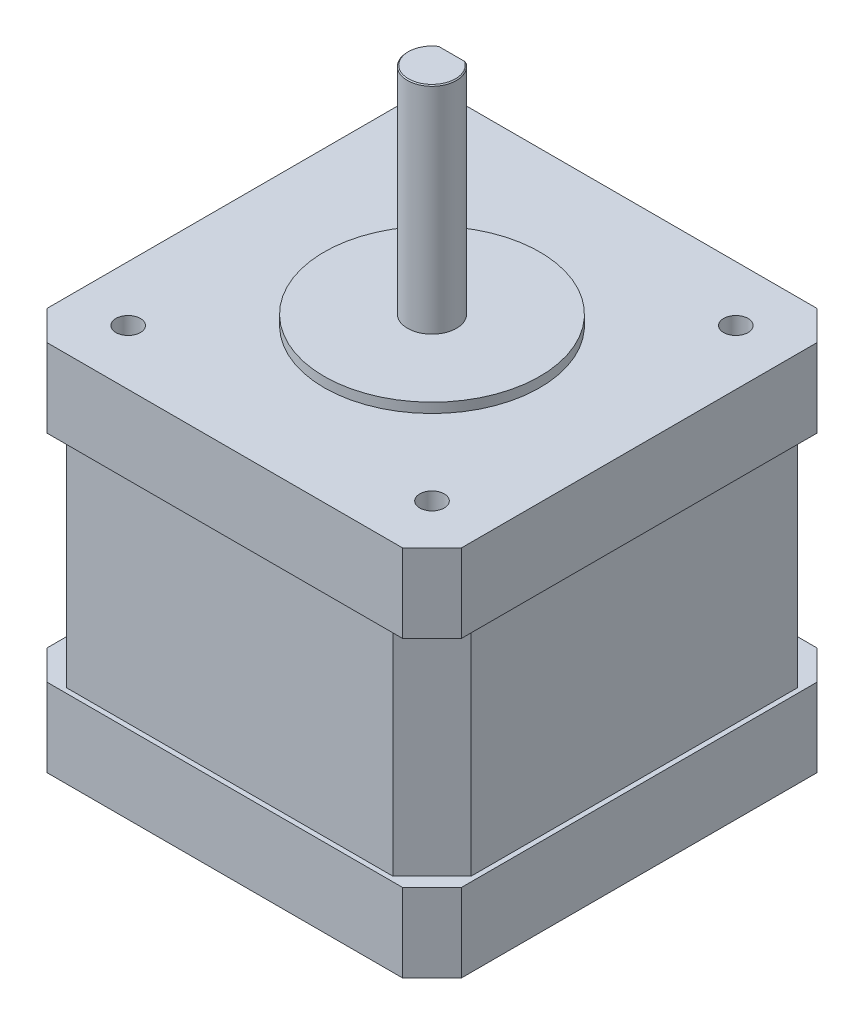
from build123d import *

# Parameters (mm, degrees)
SKETCH_2_W               = 42.3
SKETCH_2_H               = 42.3
EXTRUDE_2_DEPTH          = 8
CHAMFER_1_SIZE           = 3
SKETCH_3_W               = 42.3
SKETCH_3_H               = 42.3
EXTRUDE_3_DEPTH          = 22
EXTRUDE_4_DEPTH          = 8
CUT_EXTRUDE_1_DEPTH      = 22
CUT_EXTRUDE_START        = -8
CUT_EXTRUDE_4_DEPTH      = 22
SKETCH_7_R               = 11
EXTRUDE_5_DEPTH          = 1
SKETCH_8_R               = 2.5
EXTRUDE_6_DEPTH          = 22
CUT_EXTRUDE_6_DEPTH      = 18
HOLE_WIZARD_M3_1_D       = 2.5
SKETCH_15_W              = 42.295221422
SKETCH_15_H              = 22.0000003
CUT_EXTRUDE_8_DEPTH      = 0.5
PATTERN_CIRCULAR_1_COUNT = 4
CHAMFER_3_SIZE           = 0.1


with BuildPart() as part:
    # 草图2 → 凸台-拉伸2 (new body)
    with BuildSketch(Plane(origin=(0, 0, 0), x_dir=(1, 0, 0), z_dir=(0, 1, 0))):
        Rectangle(SKETCH_2_W, SKETCH_2_H)
    extrude(amount=EXTRUDE_2_DEPTH)

    # 倒角1
    chamfer_1_edges = [part.edges().sort_by_distance(p)[0] for p in [
        (21.15, 4, 21.15),
        (-21.15, 4, 21.15),
        (-21.15, 4, -21.15),
        (21.15, 4, -21.15),
    ]]
    chamfer(chamfer_1_edges, length=CHAMFER_1_SIZE)

    # 草图3 → 凸台-拉伸3 (add)
    with BuildSketch(Plane(origin=(0, 8, 0), x_dir=(1, 0, 0), z_dir=(0, 1, 0))):
        Rectangle(SKETCH_3_W, SKETCH_3_H)
    extrude(amount=EXTRUDE_3_DEPTH)

    # 草图4 → 凸台-拉伸4 (add)
    with BuildSketch(Plane(origin=(0, 30, 0), x_dir=(1, 0, 0), z_dir=(0, 1, 0))):
        Polygon((-21.15, 18.15), (-21.15, -18.15), (-18.15, -21.15), (18.15, -21.15), (21.15, -18.15), (21.15, 18.15), (18.15, 21.15), (-18.15, 21.15), align=None)
    extrude(amount=EXTRUDE_4_DEPTH)

    # 草图5 → 切除-拉伸1 (cut)
    with BuildSketch(Plane(origin=(0, 30, 0), x_dir=(1, 0, 0), z_dir=(0, 1, 0))):
        Polygon((-16.15, 21.15), (-21.15, 21.15), (-21.15, 16.15), align=None)
    extrude(amount=-CUT_EXTRUDE_1_DEPTH, mode=Mode.SUBTRACT)

    # 草图6 → 切除-拉伸4 (cut)
    with BuildSketch(Plane(origin=(0, 38, 0), x_dir=(1, 0, 0), z_dir=(0, 1, 0)).offset(CUT_EXTRUDE_START)):
        Polygon((-16.15, -21.15), (-21.15, -16.15), (-21.15, -18.15), (-18.15, -21.15), align=None)
        Polygon((-18.15, -21.15), (-21.15, -18.15), (-21.15, -21.15), align=None)
        Polygon((21.15, -16.15), (16.15, -21.15), (18.15, -21.15), (21.15, -18.15), align=None)
        Polygon((21.15, -18.15), (18.15, -21.15), (21.15, -21.15), align=None)
        Polygon((18.15, 21.15), (16.15, 21.15), (21.15, 16.15), (21.15, 18.15), align=None)
        Polygon((21.15, 21.15), (18.15, 21.15), (21.15, 18.15), align=None)
    extrude(amount=-CUT_EXTRUDE_4_DEPTH, mode=Mode.SUBTRACT)

    # 草图7 → 凸台-拉伸5 (add)
    with BuildSketch(Plane(origin=(0, 38, 0), x_dir=(1, 0, 0), z_dir=(0, 1, 0))):
        with Locations(Location((0, 0, 0), (0, 0, 270))):
            Circle(SKETCH_7_R)
    extrude(amount=EXTRUDE_5_DEPTH)

    # 草图8 → 凸台-拉伸6 (add)
    with BuildSketch(Plane(origin=(0, 39, 0), x_dir=(1, 0, 0), z_dir=(0, 1, 0))):
        with Locations(Location((0, 0, 0), (0, 0, 270))):
            Circle(SKETCH_8_R)
    extrude(amount=EXTRUDE_6_DEPTH)

    # 草图9 → 切除-拉伸6 (cut)
    with BuildSketch(Plane(origin=(0, 61, 0), x_dir=(1, 0, 0), z_dir=(0, 1, 0))):
        Polygon((-76.274840795, 2), (-1.5, 2), (1.5, 2), (76.274840795, 2), (76.274840795, 151.54968159), (-76.274840795, 151.54968159), align=None)
    extrude(amount=-CUT_EXTRUDE_6_DEPTH, mode=Mode.SUBTRACT)

    # M3 螺纹孔1 (through all)
    with Locations(Plane(origin=(0, 38, 0), x_dir=(1, 0, 0), z_dir=(0, 1, 0))):
        with Locations((-15.5, 15.5), (15.5, 15.5), (15.5, -15.5), (-15.5, -15.5)):
            Hole(HOLE_WIZARD_M3_1_D / 2)

    # 草图15 → 切除-拉伸8 (cut)
    with BuildSketch(Plane.ZY.offset(21.15)):
        with Locations((-0.002389289, 18.99999985)):
            Rectangle(SKETCH_15_W, SKETCH_15_H)
    cut_extrude_8 = extrude(amount=-CUT_EXTRUDE_8_DEPTH, mode=Mode.SUBTRACT)

    # 阵列(圆周)1: 切除-拉伸8 ×4 about axis
    pattern_circular_1_axis = Axis((0, 0, 0), (0, 1, 0))
    for i in range(1, PATTERN_CIRCULAR_1_COUNT):
        add(cut_extrude_8.rotate(pattern_circular_1_axis, i * 360 / PATTERN_CIRCULAR_1_COUNT), mode=Mode.SUBTRACT)

    # 倒角3
    chamfer_3_edges = [part.edges().sort_by_distance(p)[0] for p in [
        (2.371708245, 61, 0.790569415),
    ]]
    chamfer(chamfer_3_edges, length=CHAMFER_3_SIZE)


solid = part.part
